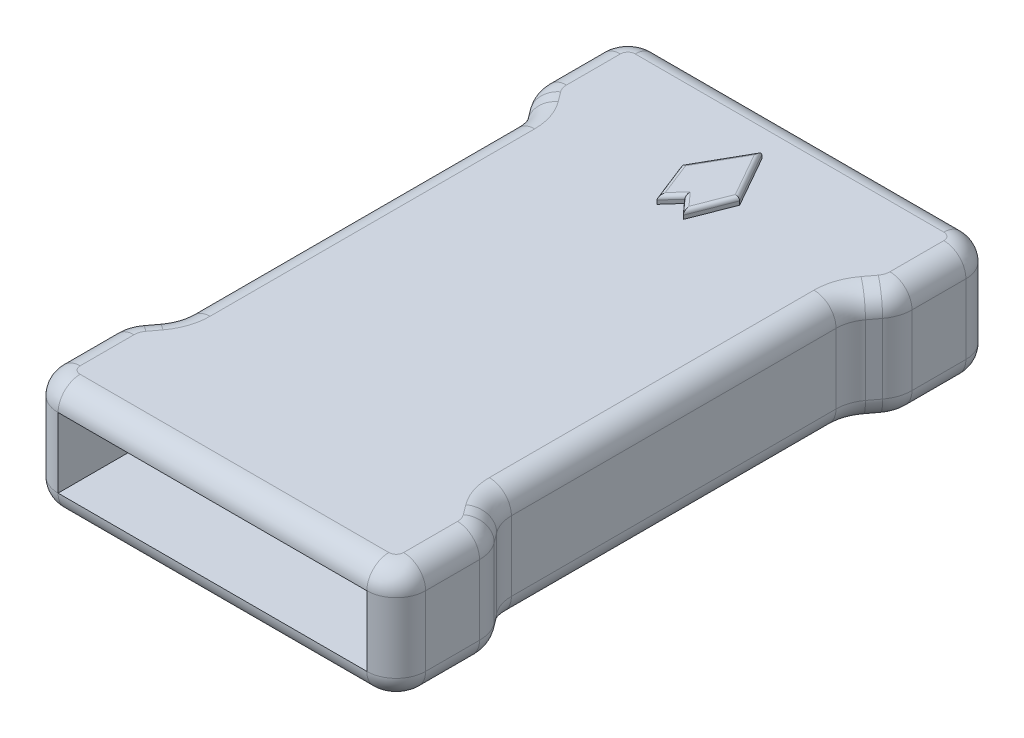
from build123d import *

# Parameters (mm, degrees)
SKETCH1_W           = 50
SKETCH1_H           = 81.5
BOSS_EXTRUDE1_DEPTH = 15.5
CUT_EXTRUDE4_DEPTH  = 51.257462133
CUT_EXTRUDE5_DEPTH  = 51.257462133
FILLET1_R           = 5
FILLET3_R           = 4
FILLET4_R           = 3
BOSS_EXTRUDE2_DEPTH = 1
FILLET5_R           = 0.5
SKETCH6_W           = 42
SKETCH6_H           = 9.5
CUT_EXTRUDE6_DEPTH  = 10


with BuildPart() as part:
    # Sketch1 → Boss-Extrude1 (new body)
    with BuildSketch(Plane(origin=(0, 0, 0), x_dir=(1, 0, 0), z_dir=(0, 1, 0))):
        Rectangle(SKETCH1_W, SKETCH1_H)
    extrude(amount=BOSS_EXTRUDE1_DEPTH)

    # Sketch2 → Cut-Extrude4 (cut, through all)
    with BuildSketch(Plane(origin=(0, 15.5, 0), x_dir=(-1, 0, 0), z_dir=(0, 1, 0))):
        Polygon((-22, 23.75), (-25, 27.75), (-25, -27.75), (-22, -23.75), align=None)
    extrude(amount=-CUT_EXTRUDE4_DEPTH, mode=Mode.SUBTRACT)

    # Sketch2<6> → Cut-Extrude5 (cut, through all)
    with BuildSketch(Plane(origin=(0, 15.5, 0), x_dir=(-1, 0, 0), z_dir=(0, 1, 0))):
        Polygon((22, -23.75), (25, -27.75), (25, 27.75), (22, 23.75), align=None)
    extrude(amount=-CUT_EXTRUDE5_DEPTH, mode=Mode.SUBTRACT)

    # Fillet1
    fillet1_edges = [part.edges().sort_by_distance(p)[0] for p in [
        (25, 7.75, -27.75),
        (25, 7.75, 27.75),
        (22, 7.75, 23.75),
        (22, 7.75, -23.75),
        (-25, 7.75, 27.75),
        (-25, 7.75, -27.75),
        (-22, 7.75, -23.75),
        (-22, 7.75, 23.75),
    ]]
    fillet(fillet1_edges, radius=FILLET1_R)

    # Fillet3
    fillet3_edges = [part.edges().sort_by_distance(p)[0] for p in [
        (25, 7.75, 40.75),
        (-25, 7.75, 40.75),
        (-25, 7.75, -40.75),
        (25, 7.75, -40.75),
    ]]
    fillet(fillet3_edges, radius=FILLET3_R)

    # Fillet4
    fillet4_edges = [part.edges().sort_by_distance(p)[0] for p in [
        (24.74341649, 0, 27.835527837),
        (23.5, 0, 25.75),
        (22.25658351, 0, 23.664472163),
        (22, 0, 0),
        (22.25658351, 0, -23.664472163),
        (23.5, 0, -25.75),
        (24.74341649, 0, -27.835527837),
        (25, 0, -33.083333333),
        (23.828427125, 0, -39.578427125),
        (0, 0, -40.75),
        (-23.828427125, 0, -39.578427125),
        (-25, 0, -33.083333333),
        (-24.74341649, 0, -27.835527837),
        (-23.5, 0, -25.75),
        (-22.25658351, 0, -23.664472163),
        (-22, 0, 0),
        (-22.25658351, 0, 23.664472163),
        (-23.5, 0, 25.75),
        (-24.74341649, 0, 27.835527837),
        (-25, 0, 33.083333333),
        (-23.828427125, 0, 39.578427125),
        (0, 0, 40.75),
        (23.828427125, 0, 39.578427125),
        (25, 0, 33.083333333),
        (-23.828427125, 15.5, 39.578427125),
        (-25, 15.5, 33.083333333),
        (-24.74341649, 15.5, 27.835527837),
        (-23.5, 15.5, 25.75),
        (-22.25658351, 15.5, 23.664472163),
        (-22, 15.5, 0),
        (-22.25658351, 15.5, -23.664472163),
        (-23.5, 15.5, -25.75),
        (-24.74341649, 15.5, -27.835527837),
        (-25, 15.5, -33.083333333),
        (-23.828427125, 15.5, -39.578427125),
        (0, 15.5, -40.75),
        (23.828427125, 15.5, -39.578427125),
        (25, 15.5, -33.083333333),
        (24.74341649, 15.5, -27.835527837),
        (23.5, 15.5, -25.75),
        (22.25658351, 15.5, -23.664472163),
        (22, 15.5, 0),
        (22.25658351, 15.5, 23.664472163),
        (23.5, 15.5, 25.75),
        (24.74341649, 15.5, 27.835527837),
        (25, 15.5, 33.083333333),
        (23.828427125, 15.5, 39.578427125),
        (0, 15.5, 40.75),
    ]]
    fillet(fillet4_edges, radius=FILLET4_R)

    # Sketch6 → Cut-Extrude6 (cut)
    with BuildSketch(Plane.XY.offset(40.75)):
        with Locations((0, 7.75)):
            Rectangle(SKETCH6_W, SKETCH6_H)
    extrude(amount=-CUT_EXTRUDE6_DEPTH, mode=Mode.SUBTRACT)


with BuildPart() as body_2:
    # Sketch5 → Boss-Extrude2 (new body)
    with BuildSketch(Plane(origin=(0, 15.5, 0), x_dir=(-1, 0, 0), z_dir=(0, 1, 0))):
        Polygon((0, -23.506374229), (1.781243622, -21.517911068), (3.937786411, -27.033800367), (0, -33.980226737), (-3.937786411, -27.033800367), (-1.781243622, -21.517911068), align=None)
    extrude(amount=BOSS_EXTRUDE2_DEPTH)

    # Fillet5
    fillet5_edges = [body_2.edges().sort_by_distance(p)[0] for p in [
        (1.968893205, 16.5, -30.507013552),
        (-1.968893205, 16.5, -30.507013552),
        (-2.859515016, 16.5, -24.275855717),
        (-0.890621811, 16.5, -22.512142648),
        (0.890621811, 16.5, -22.512142648),
        (2.859515016, 16.5, -24.275855717),
    ]]
    fillet(fillet5_edges, radius=FILLET5_R)


solid = Compound([part.part, body_2.part])
